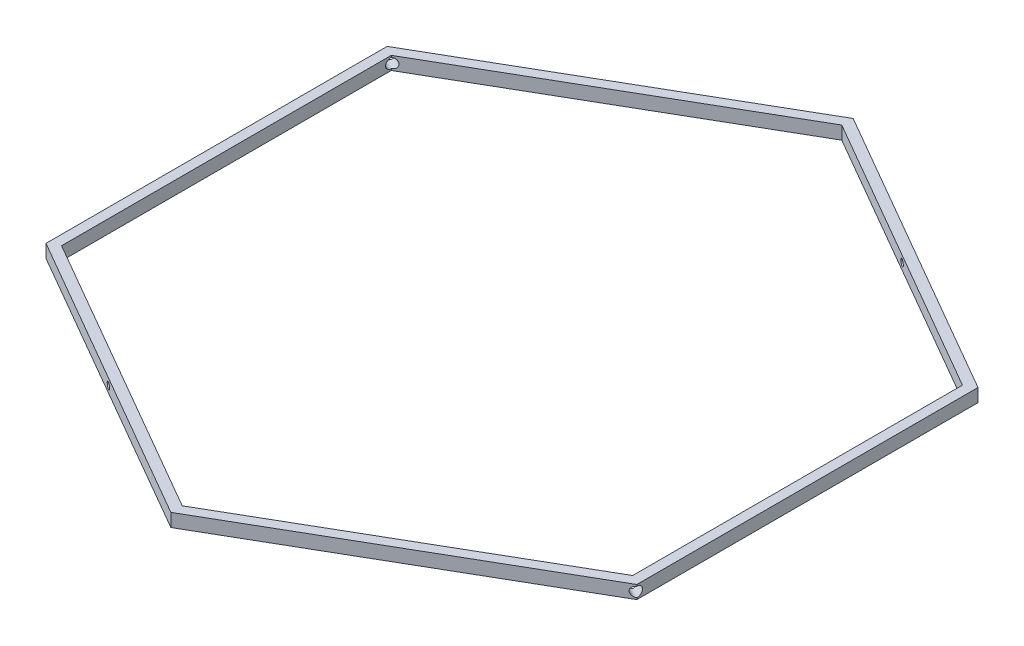
from build123d import *

# Parameters (mm, degrees)
RESSALTO_EXTRUS_O1_DEPTH   = 4
ESBO_O2_R                  = 1
CORTE_EXTRUS_O1_DEPTH      = 227.530351
CORTE_EXTRUS_O2_DEPTH      = 186.712143
CORTE_EXTRUS_O2_DEPTH_BACK = 186.712143
ESBO_O3_R                  = 1.5


with BuildPart() as part:
    # Esboço1 → Ressalto-extrusão1 (new body)
    with BuildSketch(Plane(origin=(0, 0, 0), x_dir=(1, 0, 0), z_dir=(0, 1, 0))):
        Polygon((90, -51.961524), (90, 51.961524), (0, 103.923048), (-90, 51.961524), (-90, -51.961524), (0, -103.923048), align=None)
        Polygon((87, 50.229473), (0, 100.458947), (-87, 50.229473), (-87, -50.229473), (0, -100.458947), (87, -50.229473), align=None, mode=Mode.SUBTRACT)
    extrude(amount=RESSALTO_EXTRUS_O1_DEPTH)

    # Esboço2 → Corte-extrusão1 (cut, through all)
    with BuildSketch(Plane(origin=(-45, 0, 77.942286), x_dir=(0.8660254037844387, 0, 0.49999999999999994), z_dir=(-0.4999999999999999, 0, 0.8660254037844386))):
        with Locations((0, 2)):
            Circle(ESBO_O2_R)
    extrude(amount=-CORTE_EXTRUS_O1_DEPTH, mode=Mode.SUBTRACT)

    # Esboço3 → Corte-extrusão2 (cut, two sides: drawn at the far end of the back side and taken through both)
    with BuildSketch(Plane(origin=(-43.5, 0, -25.114737), x_dir=(-0.5, 0, 0.8660254037844386), z_dir=(-0.8660254037844387, 0, -0.5000000000000001)).offset(-CORTE_EXTRUS_O2_DEPTH_BACK)):
        with Locations(Location((0, 2, 0), (0, 0, 90))):
            Circle(ESBO_O3_R)
    extrude(amount=CORTE_EXTRUS_O2_DEPTH + CORTE_EXTRUS_O2_DEPTH_BACK, mode=Mode.SUBTRACT)


solid = part.part
